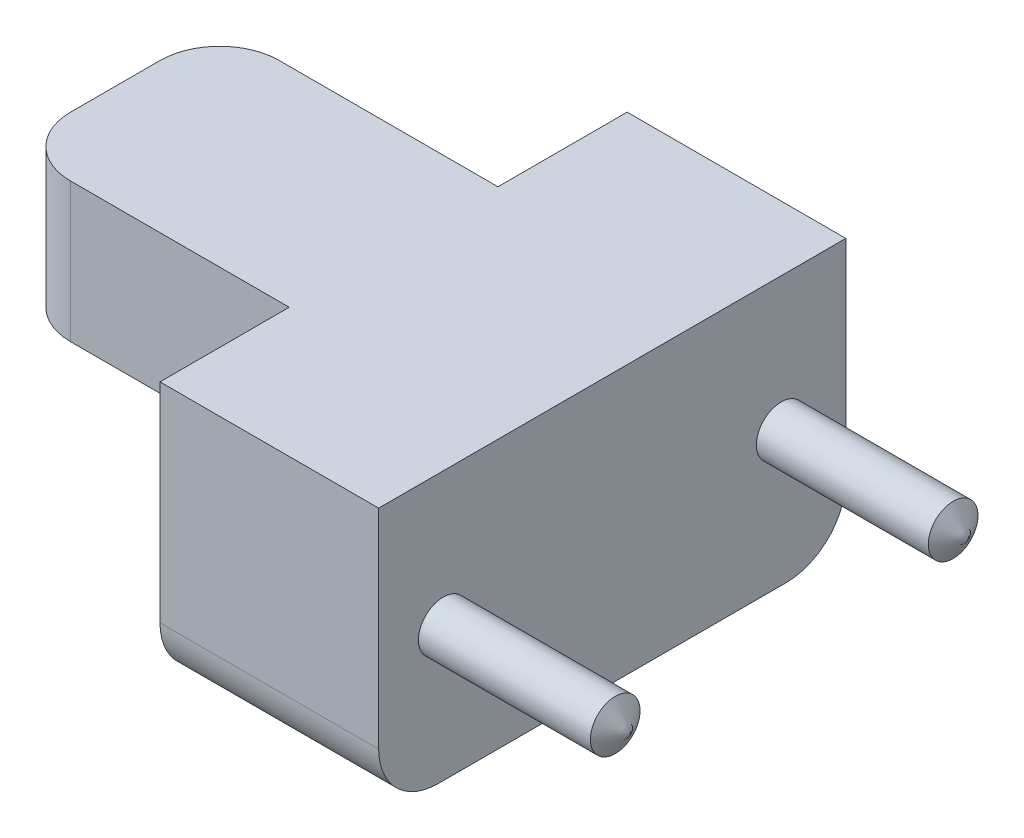
from build123d import *

# Parameters (mm, degrees)
SKIZZE1_W                       = 22
SKIZZE1_H                       = 47.002
AUFSATZ_LINEAR_AUSTRAGEN1_DEPTH = 27
VERRUNDUNG1_R                   = 6
SKIZZE2_W                       = 21
SKIZZE2_H                       = 14
AUFSATZ_LINEAR_AUSTRAGEN2_DEPTH = 28
VERRUNDUNG2_R                   = 6
SKIZZE3_R                       = 2.5
AUFSATZ_LINEAR_AUSTRAGEN3_DEPTH = 17.3


with BuildPart() as part:
    # Skizze1 → Aufsatz-Linear austragen1 (new body)
    with BuildSketch(Plane(origin=(0, 0, 0), x_dir=(1, 0, 0), z_dir=(0, 1, 0))):
        with Locations((11, 0)):
            Rectangle(SKIZZE1_W, SKIZZE1_H)
    extrude(amount=AUFSATZ_LINEAR_AUSTRAGEN1_DEPTH)

    # Verrundung1
    verrundung1_edges = [part.edges().sort_by_distance(p)[0] for p in [
        (11, 0, -23.501),
        (11, 0, 23.501),
    ]]
    fillet(verrundung1_edges, radius=VERRUNDUNG1_R)

    # Skizze2 → Aufsatz-Linear austragen2 (add)
    with BuildSketch(Plane.ZY):
        with Locations((0, 20)):
            Rectangle(SKIZZE2_W, SKIZZE2_H)
    extrude(amount=AUFSATZ_LINEAR_AUSTRAGEN2_DEPTH)

    # Verrundung2
    verrundung2_edges = [part.edges().sort_by_distance(p)[0] for p in [
        (-28, 20, -10.5),
        (-28, 20, 10.5),
    ]]
    fillet(verrundung2_edges, radius=VERRUNDUNG2_R)

    # Skizze3 → Aufsatz-Linear austragen3 (add)
    with BuildSketch(Plane(origin=(22, 0, 0), x_dir=(0, 0, -1), z_dir=(1, 0, 0))):
        with Locations(Location((17, 13.5, 0), (0, 0, 180))):
            Circle(SKIZZE3_R)
        with Locations(Location((-17, 13.5, 0), (0, 0, 180))):
            Circle(SKIZZE3_R)
    extrude(amount=AUFSATZ_LINEAR_AUSTRAGEN3_DEPTH)

    # Skizze4 → Rotation2 (revolve)
    with BuildSketch(Plane(origin=(0, 13.5, 0), x_dir=(-1, 0, 0), z_dir=(0, 1, 0)), mode=Mode.PRIVATE) as rotation2_sk:
        Polygon((-39.3, 14.5), (-40.802151548, 17), (-39.3, 17), align=None)
    revolve(rotation2_sk.sketch.rotate(Axis((39.3, 13.5, 17), (1, 0, 0)), 180), axis=Axis((39.3, 13.5, 17), (1, 0, 0)))

    # Skizze5 → Rotation3 (revolve)
    with BuildSketch(Plane(origin=(0, 13.5, 0), x_dir=(-1, 0, 0), z_dir=(0, 1, 0)), mode=Mode.PRIVATE) as rotation3_sk:
        Polygon((-39.3, -19.5), (-39.3, -17), (-40.802151548, -17), align=None)
    revolve(rotation3_sk.sketch.rotate(Axis((39.3, 13.5, -17), (1, 0, 0)), 180), axis=Axis((39.3, 13.5, -17), (1, 0, 0)))


solid = part.part
